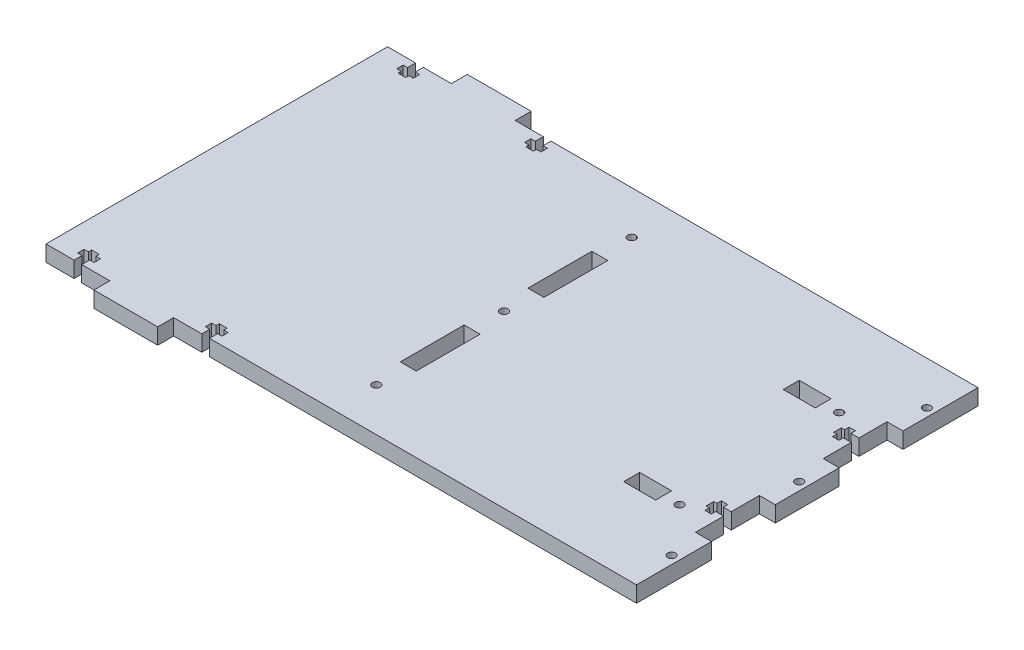
from build123d import *

# Parameters (mm, degrees)
SKETCH1_R           = 1.5875
SKETCH1_W           = 6.35
SKETCH1_H           = 25.4
BOSS_EXTRUDE1_DEPTH = 6.35


with BuildPart() as part:
    # Sketch1 → Boss-Extrude1 (new body)
    with BuildSketch(Plane(origin=(0, 0, 0), x_dir=(1, 0, 0), z_dir=(0, 1, 0))):
        Polygon((-153.849110766, 19.370876928), (-153.849110766, -116.519123072), (-142.673040444, -116.519123072), (-142.673040444, -113.344123072), (-144.425640444, -113.344123072), (-144.425640444, -110.804123072), (-142.673040444, -110.804123072), (-142.673040444, -109.534123072), (-139.625181088, -109.534123072), (-139.625181088, -110.804123072), (-137.872581088, -110.804123072), (-137.872581088, -113.344123072), (-139.625181088, -113.344123072), (-139.625181088, -116.519123072), (-128.449110766, -116.519123072), (-128.449110766, -122.869123072), (-103.049110766, -122.869123072), (-103.049110766, -116.519123072), (-91.873040444, -116.519123072), (-91.873040444, -113.344123072), (-93.625640444, -113.344123072), (-93.625640444, -110.804123072), (-91.873040444, -110.804123072), (-91.873040444, -109.534123072), (-88.825181088, -109.534123072), (-88.825181088, -110.804123072), (-87.072581088, -110.804123072), (-87.072581088, -113.344123072), (-88.825181088, -113.344123072), (-88.825181088, -116.519123072), (-77.649110766, -116.519123072), (74.750889234, -116.519123072), (81.100889234, -116.519123072), (81.100889234, -86.674123072), (74.750889234, -86.674123072), (74.750889234, -75.49805275), (71.575889234, -75.49805275), (71.575889234, -77.25065275), (69.035889234, -77.25065275), (69.035889234, -75.49805275), (67.765889234, -75.49805275), (67.765889234, -72.450193394), (69.035889234, -72.450193394), (69.035889234, -70.697593394), (71.575889234, -70.697593394), (71.575889234, -72.450193394), (74.750889234, -72.450193394), (74.750889234, -61.274123072), (81.100889234, -61.274123072), (81.100889234, -35.874123072), (74.750889234, -35.874123072), (74.750889234, -24.69805275), (71.575889234, -24.69805275), (71.575889234, -26.45065275), (69.035889234, -26.45065275), (69.035889234, -24.69805275), (67.765889234, -24.69805275), (67.765889234, -21.650193394), (69.035889234, -21.650193394), (69.035889234, -19.897593394), (71.575889234, -19.897593394), (71.575889234, -21.650193394), (74.750889234, -21.650193394), (74.750889234, -10.474123072), (81.100889234, -10.474123072), (81.100889234, 19.370876928), (74.750889234, 19.370876928), (-77.649110766, 19.370876928), (-88.825181088, 19.370876928), (-88.825181088, 16.195876928), (-87.072581088, 16.195876928), (-87.072581088, 13.655876928), (-88.825181088, 13.655876928), (-88.825181088, 12.385876928), (-91.873040444, 12.385876928), (-91.873040444, 13.655876928), (-93.625640444, 13.655876928), (-93.625640444, 16.195876928), (-91.873040444, 16.195876928), (-91.873040444, 19.370876928), (-103.049110766, 19.370876928), (-103.049110766, 25.720876928), (-128.449110766, 25.720876928), (-128.449110766, 19.370876928), (-139.625181088, 19.370876928), (-139.625181088, 16.195876928), (-137.872581088, 16.195876928), (-137.872581088, 13.655876928), (-139.625181088, 13.655876928), (-139.625181088, 12.385876928), (-142.673040444, 12.385876928), (-142.673040444, 13.655876928), (-144.425640444, 13.655876928), (-144.425640444, 16.195876928), (-142.673040444, 16.195876928), (-142.673040444, 19.370876928), align=None)
        with Locations(Location((-39.549110766, 2.225876928, 0), (0, 0, 270))):
            Circle(SKETCH1_R, mode=Mode.SUBTRACT)
        with Locations(Location((-39.549110766, -48.574123072, 0), (0, 0, 270))):
            Circle(SKETCH1_R, mode=Mode.SUBTRACT)
        with Locations(Location((-39.549110766, -99.374123072, 0), (0, 0, 270))):
            Circle(SKETCH1_R, mode=Mode.SUBTRACT)
        with Locations(Location((77.925889234, 2.225876928, 0), (0, 0, 270))):
            Circle(SKETCH1_R, mode=Mode.SUBTRACT)
        with Locations(Location((77.925889234, -48.574123072, 0), (0, 0, 270))):
            Circle(SKETCH1_R, mode=Mode.SUBTRACT)
        with Locations(Location((77.925889234, -99.374123072, 0), (0, 0, 270))):
            Circle(SKETCH1_R, mode=Mode.SUBTRACT)
        with Locations(Location((62.050889234, -80.324123072, 0), (0, 0, 270))):
            Circle(SKETCH1_R, mode=Mode.SUBTRACT)
        with Locations(Location((62.050889234, -16.824123072, 0), (0, 0, 270))):
            Circle(SKETCH1_R, mode=Mode.SUBTRACT)
        with Locations((-39.549110766, -23.174123072)):
            Rectangle(SKETCH1_W, SKETCH1_H, mode=Mode.SUBTRACT)
        with Locations((-39.549110766, -73.974123072)):
            Rectangle(SKETCH1_W, SKETCH1_H, mode=Mode.SUBTRACT)
        Polygon((49.350889234, -77.149123072), (43.000889234, -77.149123072), (43.000889234, -83.499123072), (55.700889234, -83.499123072), (55.700889234, -77.149123072), align=None, mode=Mode.SUBTRACT)
        Polygon((49.350889234, -19.999123072), (43.000889234, -19.999123072), (43.000889234, -13.649123072), (55.700889234, -13.649123072), (55.700889234, -19.999123072), align=None, mode=Mode.SUBTRACT)
    extrude(amount=BOSS_EXTRUDE1_DEPTH)


solid = part.part
